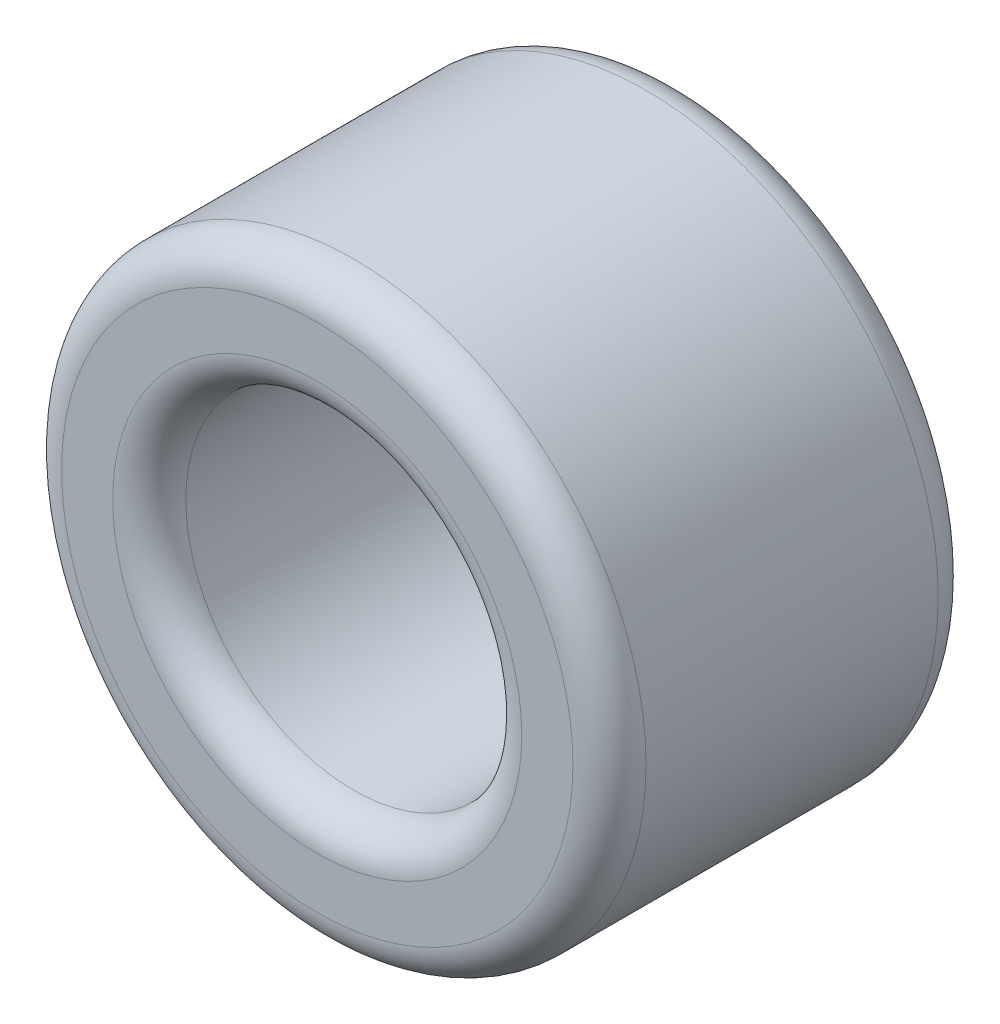
from build123d import *

# Parameters (mm, degrees)
SKETCH_1_R      = 4
SKETCH_1_R_2    = 2.3
EXTRUDE_1_DEPTH = 5
FILLET_1_R      = 0.5


with BuildPart() as part:
    # 草图1 → 凸台-拉伸1 (new body)
    with BuildSketch(Plane.XY):
        Circle(SKETCH_1_R)
        Circle(SKETCH_1_R_2, mode=Mode.SUBTRACT)
    extrude(amount=EXTRUDE_1_DEPTH)

    # 圆角1
    fillet_1_edges = [part.edges().sort_by_distance(p)[0] for p in [
        (-4, 0, 0),
        (-4, 0, 5),
        (-2.3, 0, 0),
        (-2.3, 0, 5),
    ]]
    fillet(fillet_1_edges, radius=FILLET_1_R)


solid = part.part
